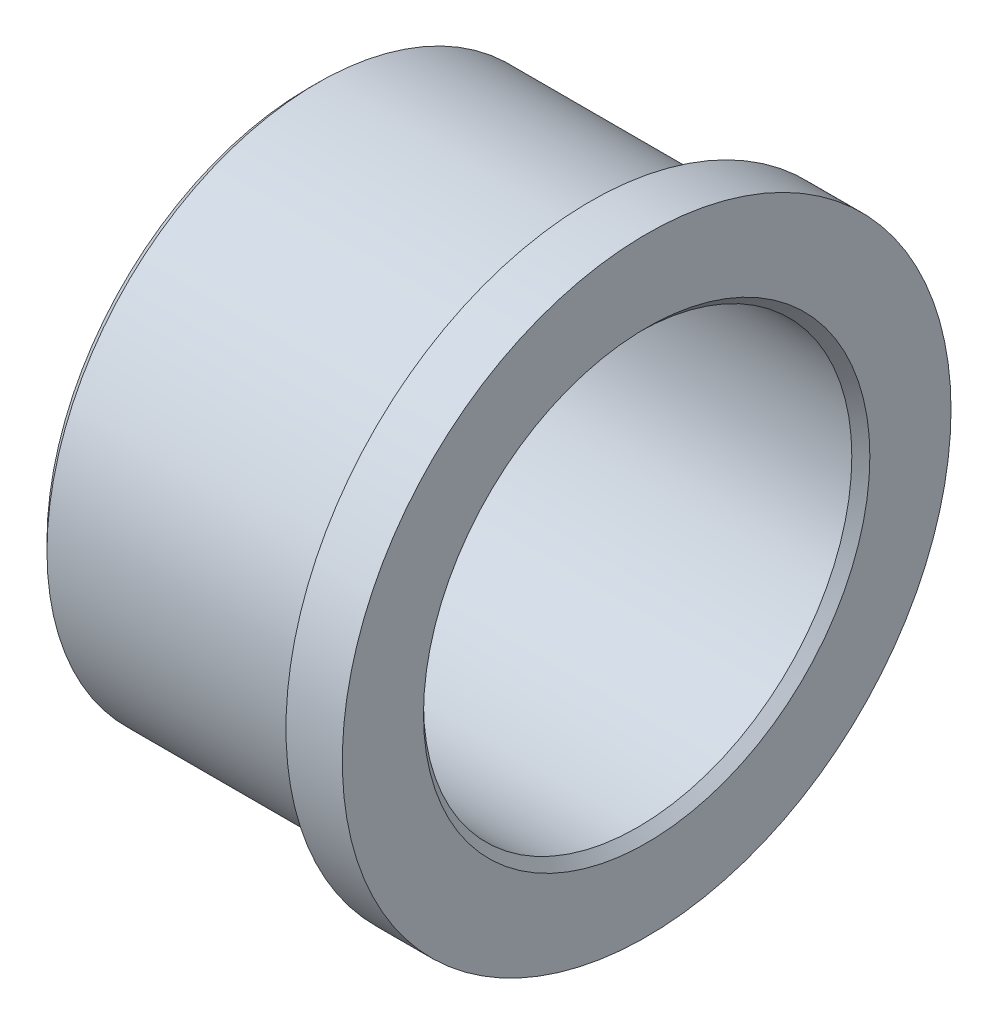
from build123d import *

# Parameters (mm, degrees)
FASE1_SIZE = 0.8


with BuildPart() as part:
    # Skizze1 → Rotation1 (revolve)
    with BuildSketch(Plane.XY, mode=Mode.PRIVATE) as rotation1_sk:
        Polygon((-2, 24), (-25, 24), (-25, 19), (5, 19), (5, 27), (0, 27), (0, 25.369078951), (0, 23.8), (-2, 23.8), align=None)
    revolve(rotation1_sk.sketch.rotate(Axis((6.5, 0, 0), (-1, 0, 0)), 90), axis=Axis((6.5, 0, 0), (-1, 0, 0)))

    # Fase1
    fase1_edges = [part.edges().sort_by_distance(p)[0] for p in [
        (-25, 0, 24),
        (-25, 0, 19),
        (5, 0, 19),
    ]]
    chamfer(fase1_edges, length=FASE1_SIZE)


solid = part.part
